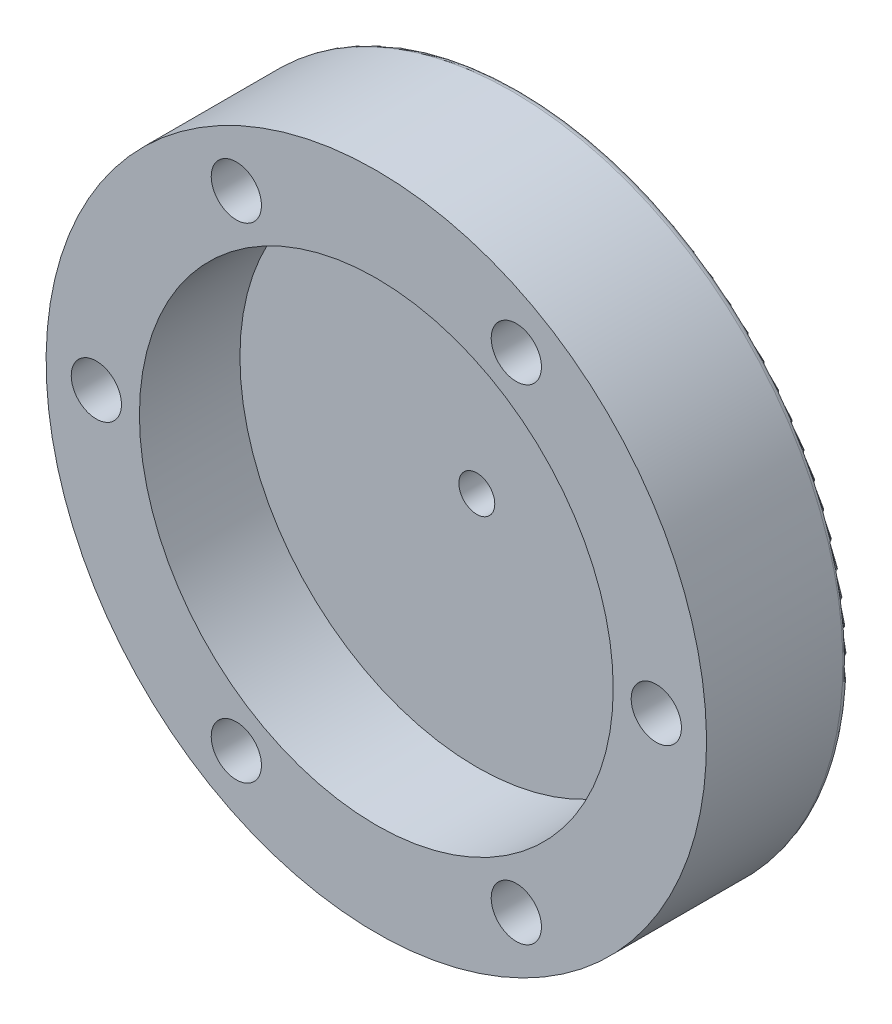
from build123d import *

# Parameters (mm, degrees)
SKETCH2_R          = 3.5
CUT_EXTRUDE1_DEPTH = 69.058798109
SKETCH3_R          = 7
CUT_EXTRUDE2_DEPTH = 10
SKETCH3_3_R        = 2.5
CUT_EXTRUDE3_DEPTH = 72.637978754
FILLET1_R          = 1


with BuildPart() as part:
    # Sketch1 → Revolve1 (revolve)
    with BuildSketch(Plane(origin=(0, 0, 0), x_dir=(0, 0, -1), z_dir=(1, 0, 0))):
        Polygon((0, 33), (-14, 33), (-14, 46), (6, 46), (6, 12), (16, 12), (16, 0), (0, 0), align=None)
    revolve(axis=Axis((0, 0, -16), (0, 0, 1)))

    # Sketch2 → Cut-Extrude1 (cut, through all)
    with BuildSketch(Plane(origin=(0, 0, -6), x_dir=(-1, 0, 0), z_dir=(0, 0, -1))):
        with Locations((19.5, -33.774990748)):
            Circle(SKETCH2_R)
        with Locations((-19.5, -33.774990748)):
            Circle(SKETCH2_R)
        with Locations((-39, 0)):
            Circle(SKETCH2_R)
        with Locations((-19.5, 33.774990748)):
            Circle(SKETCH2_R)
        with Locations((19.5, 33.774990748)):
            Circle(SKETCH2_R)
        with Locations((39, 0)):
            Circle(SKETCH2_R)
    extrude(amount=-CUT_EXTRUDE1_DEPTH, mode=Mode.SUBTRACT)

    # Sketch3 → Cut-Extrude2 (cut)
    with BuildSketch(Plane(origin=(0, 0, -16), x_dir=(-1, 0, 0), z_dir=(0, 0, -1))):
        Circle(SKETCH3_R)
    extrude(amount=-CUT_EXTRUDE2_DEPTH, mode=Mode.SUBTRACT)

    # Sketch3<3> → Cut-Extrude3 (cut, through all)
    with BuildSketch(Plane(origin=(0, 0, -16), x_dir=(-1, 0, 0), z_dir=(0, 0, -1))):
        Circle(SKETCH3_3_R)
    extrude(amount=-CUT_EXTRUDE3_DEPTH, mode=Mode.SUBTRACT)

    # Fillet1
    fillet1_edges = [part.edges().sort_by_distance(p)[0] for p in [
        (0, -46, -6),
    ]]
    fillet(fillet1_edges, radius=FILLET1_R)


solid = part.part
